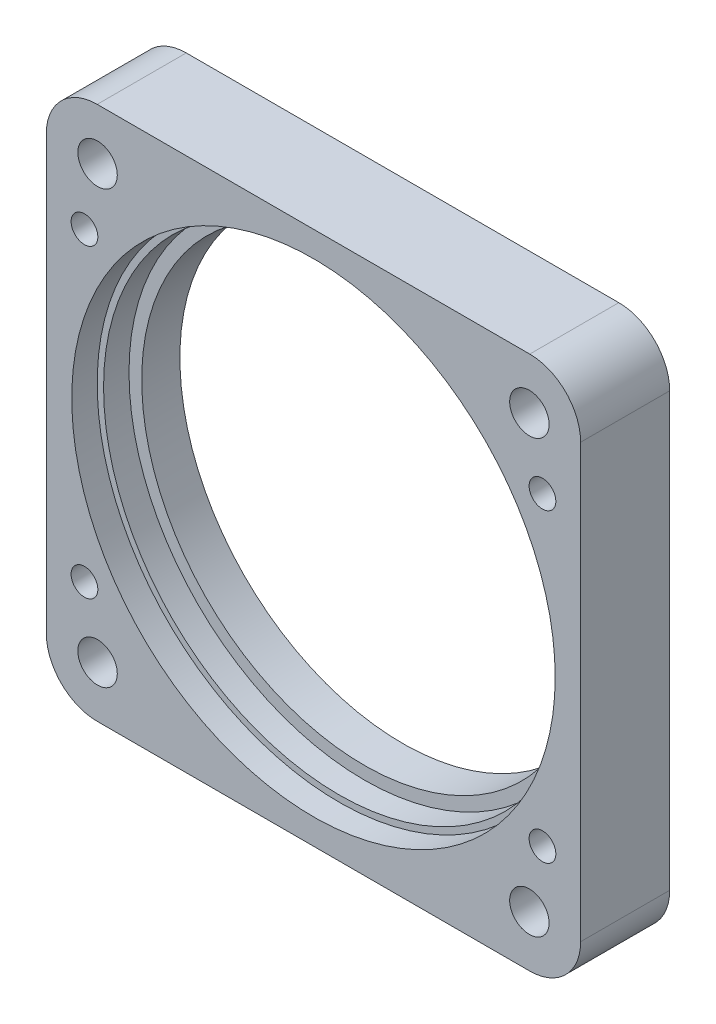
from build123d import *

# Parameters (mm, degrees)
SKETCH_1_W          = 42
SKETCH_1_H          = 42
EXTRUDE_1_DEPTH     = 7
SKETCH_2_R          = 17.5
CUT_EXTRUDE_1_DEPTH = 31.512292605
SKETCH_3_R          = 18.5
CUT_EXTRUDE_2_DEPTH = 4
SKETCH_4_R          = 19
CUT_EXTRUDE_3_DEPTH = 2
FILLET_1_R          = 4
SKETCH_5_R          = 1.55
CUT_EXTRUDE_4_DEPTH = 31.512292605
SKETCH_7_R          = 1.05
CUT_EXTRUDE_5_DEPTH = 31.512292605
SKETCH_8_R          = 2
CUT_EXTRUDE_6_DEPTH = 3


with BuildPart() as part:
    # 草图1 → 凸台-拉伸1 (new body)
    with BuildSketch(Plane.XY):
        Rectangle(SKETCH_1_W, SKETCH_1_H)
    extrude(amount=EXTRUDE_1_DEPTH)

    # 草图2 → 切除-拉伸1 (cut, through all)
    with BuildSketch(Plane.XY.offset(7)):
        Circle(SKETCH_2_R)
    extrude(amount=-CUT_EXTRUDE_1_DEPTH, mode=Mode.SUBTRACT)

    # 草图3 → 切除-拉伸2 (cut)
    with BuildSketch(Plane.XY.offset(7)):
        Circle(SKETCH_3_R)
    extrude(amount=-CUT_EXTRUDE_2_DEPTH, mode=Mode.SUBTRACT)

    # 草图4 → 切除-拉伸3 (cut)
    with BuildSketch(Plane.XY.offset(7)):
        Circle(SKETCH_4_R)
    extrude(amount=-CUT_EXTRUDE_3_DEPTH, mode=Mode.SUBTRACT)

    # 圆角1
    fillet_1_edges = [part.edges().sort_by_distance(p)[0] for p in [
        (21, -21, 3.5),
        (-21, -21, 3.5),
        (-21, 21, 3.5),
        (21, 21, 3.5),
    ]]
    fillet(fillet_1_edges, radius=FILLET_1_R)

    # 草图5 → 切除-拉伸4 (cut, through all)
    with BuildSketch(Plane.XY.offset(7)):
        with Locations((-16.970562748, 16.970562748)):
            Circle(SKETCH_5_R)
        with Locations((16.970562748, 16.970562748)):
            Circle(SKETCH_5_R)
        with Locations((16.970562748, -16.970562748)):
            Circle(SKETCH_5_R)
        with Locations((-16.970562748, -16.970562748)):
            Circle(SKETCH_5_R)
    extrude(amount=-CUT_EXTRUDE_4_DEPTH, mode=Mode.SUBTRACT)

    # 草图7 → 切除-拉伸5 (cut, through all)
    with BuildSketch(Plane(origin=(0, 0, 0), x_dir=(-1, 0, 0), z_dir=(0, 0, -1))):
        with Locations((-18, 12)):
            Circle(SKETCH_7_R)
        with Locations(Location((18, 12, 0), (0, 0, 180))):
            Circle(SKETCH_7_R)
        with Locations((18, -12)):
            Circle(SKETCH_7_R)
        with Locations(Location((-18, -12, 0), (0, 0, 180))):
            Circle(SKETCH_7_R)
    extrude(amount=-CUT_EXTRUDE_5_DEPTH, mode=Mode.SUBTRACT)

    # 草图8 → 切除-拉伸6 (cut)
    with BuildSketch(Plane(origin=(0, 0, 0), x_dir=(-1, 0, 0), z_dir=(0, 0, -1))):
        with Locations((-18, 12)):
            Circle(SKETCH_8_R)
        with Locations(Location((18, 12, 0), (0, 0, 180))):
            Circle(SKETCH_8_R)
        with Locations((18, -12)):
            Circle(SKETCH_8_R)
        with Locations(Location((-18, -12, 0), (0, 0, 180))):
            Circle(SKETCH_8_R)
    extrude(amount=-CUT_EXTRUDE_6_DEPTH, mode=Mode.SUBTRACT)


solid = part.part
